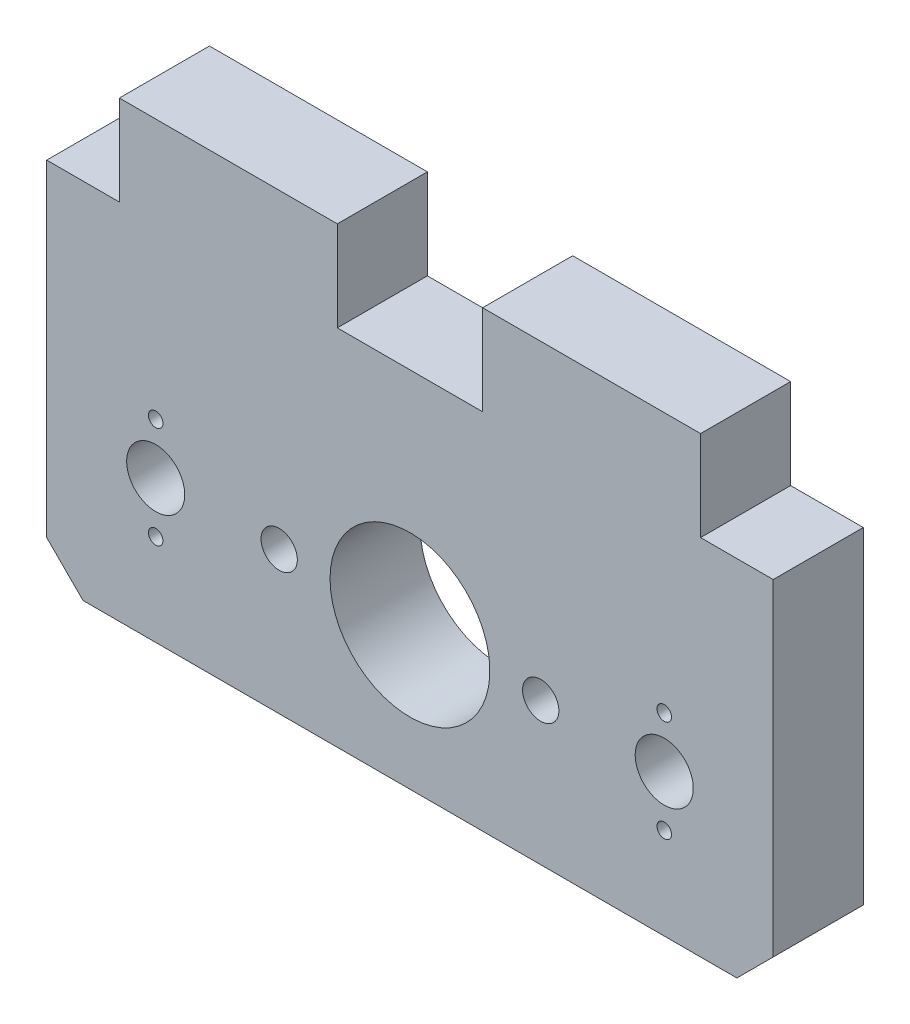
from build123d import *

# Parameters (mm, degrees)
MODEL_R             = 11
MODEL_R_2           = 4
MODEL_R_3           = 1
MODEL_R_4           = 2.5
BOSS_EXTRUDE1_DEPTH = 12.4


with BuildPart() as part:
    # Model → Boss-Extrude1 (new body)
    with BuildSketch(Plane.XY):
        Polygon((-45, 0), (-50, 5), (-50, 50), (-40, 50), (-40, 62.4), (-10, 62.4), (-10, 50), (10, 50), (10, 62.4), (40, 62.4), (40, 50), (50, 50), (50, 5), (45, 0), align=None)
        with Locations(Location((0, 19.6, 0), (0, 0, 180))):
            Circle(MODEL_R, mode=Mode.SUBTRACT)
        with Locations(Location((-35, 19.6, 0), (0, 0, 180))):
            Circle(MODEL_R_2, mode=Mode.SUBTRACT)
        with Locations(Location((35, 19.6, 0), (0, 0, 180))):
            Circle(MODEL_R_2, mode=Mode.SUBTRACT)
        with Locations(Location((-35, 26.6, 0), (0, 0, 180))):
            Circle(MODEL_R_3, mode=Mode.SUBTRACT)
        with Locations(Location((-35, 12.6, 0), (0, 0, 180))):
            Circle(MODEL_R_3, mode=Mode.SUBTRACT)
        with Locations(Location((35, 12.6, 0), (0, 0, 180))):
            Circle(MODEL_R_3, mode=Mode.SUBTRACT)
        with Locations(Location((35, 26.6, 0), (0, 0, 180))):
            Circle(MODEL_R_3, mode=Mode.SUBTRACT)
        with Locations(Location((-18, 19.6, 0), (0, 0, 180))):
            Circle(MODEL_R_4, mode=Mode.SUBTRACT)
        with Locations(Location((18, 19.6, 0), (0, 0, 180))):
            Circle(MODEL_R_4, mode=Mode.SUBTRACT)
    extrude(amount=BOSS_EXTRUDE1_DEPTH)


solid = part.part
